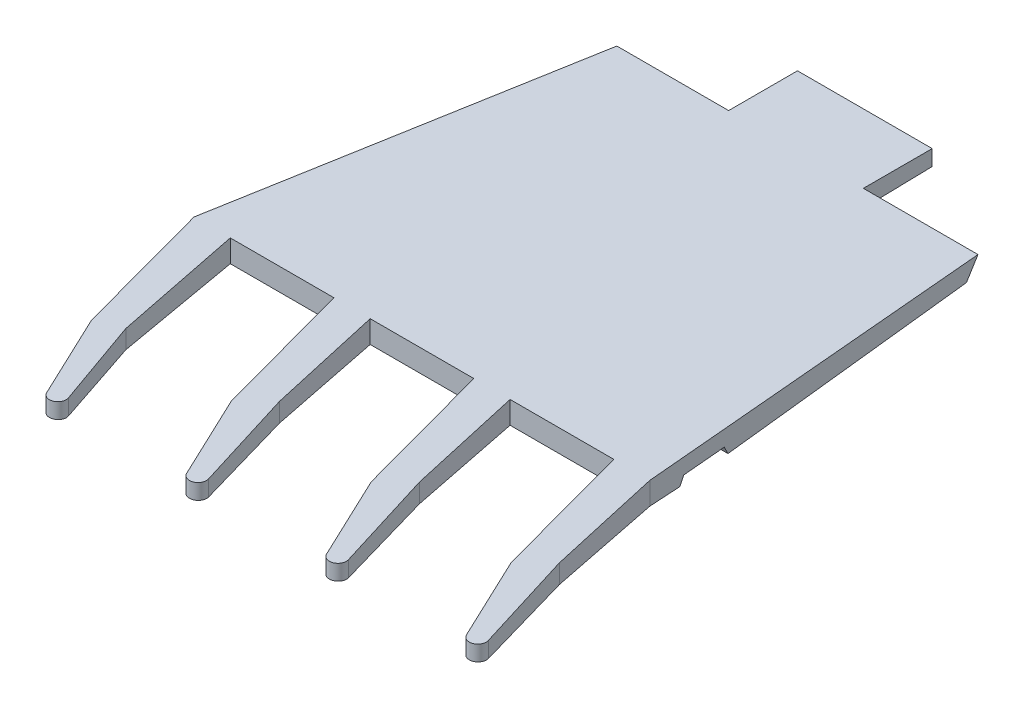
from build123d import *

# Parameters (mm, degrees)
BOSS_EXTRUDE1_START = -28
BOSS_EXTRUDE1_DEPTH = 99.579374
SKETCH3_OUTSIDE_W   = 133.993
SKETCH3_OUTSIDE_H   = 162.204
CUT_EXTRUDE1_DEPTH  = 100.62191519
CUT_EXTRUDE2_START  = 5.803625
CUT_EXTRUDE2_DEPTH  = 106.16593176
CUT_EXTRUDE3_START  = 31.803625
CUT_EXTRUDE3_DEPTH  = 68.55868176


with BuildPart() as part:
    # Sketch2 → Boss-Extrude1 (new body)
    with BuildSketch(Plane(origin=(0, 0, 0), x_dir=(0, 0, -1), z_dir=(1, 0, 0)).offset(BOSS_EXTRUDE1_START)):
        Polygon((2.933887978, -4.509005443), (69.141796865, -3.002833844), (69.107645371, 0), (-58.647538152, 0), (-58.647538152, -2.95683283), (-7.216010497, -4.507485825), (-6.427384886, -3.00760388), (2.14571152, -3.008887422), align=None)
    extrude(amount=BOSS_EXTRUDE1_DEPTH)

    # Sketch3 outside → Cut-Extrude1 (cut, through all)
    with BuildSketch(Plane(origin=(0, 0, 0), x_dir=(1, 0, 0), z_dir=(0, 1, 0))):
        with Locations((21.7895, 5.247)):
            Rectangle(SKETCH3_OUTSIDE_W, SKETCH3_OUTSIDE_H)
        with BuildLine():
            Line((-28, -13.55551403), (-20.63757447, -40.708643472))
            Line((-20.63757447, -40.708643472), (-12.858995884, -57.128824119))
            ThreePointArc((-12.858995884, -57.128824119), (-10.789353945, -57.92833017), (-9.884782678, -55.902403591))
            Line((-9.884782678, -55.902403591), (-15.939111366, -38.776868951))
            Line((-15.939111366, -38.776868951), (-21, -13.55551403))
            Line((-21, -13.55551403), (-1, -13.55551403))
            Line((-1, -13.55551403), (6.36242553, -40.708643472))
            Line((6.36242553, -40.708643472), (14.127689055, -57.10071671))
            ThreePointArc((14.127689055, -57.10071671), (16.204899684, -57.927331709), (17.177753002, -55.914459936))
            Line((17.177753002, -55.914459936), (11.060888634, -36.101526091))
            Line((11.060888634, -36.101526091), (6, -13.55551403))
            Line((6, -13.55551403), (26, -13.55551403))
            Line((26, -13.55551403), (33.36242553, -40.708643472))
            Line((33.36242553, -40.708643472), (41.127689055, -57.10071671))
            ThreePointArc((41.127689055, -57.10071671), (43.204899684, -57.927331709), (44.177753002, -55.914459936))
            Line((44.177753002, -55.914459936), (38.060888634, -36.101526091))
            Line((38.060888634, -36.101526091), (33, -13.55551403))
            Line((33, -13.55551403), (53, -13.55551403))
            Line((53, -13.55551403), (60.36242553, -40.708643472))
            Line((60.36242553, -40.708643472), (68.127689055, -57.10071671))
            ThreePointArc((68.127689055, -57.10071671), (70.204899684, -57.927331709), (71.177753002, -55.914459936))
            Line((71.177753002, -55.914459936), (65.060888634, -36.101526091))
            Line((65.060888634, -36.101526091), (60, -13.55551403))
            Line((60, -13.55551403), (52.767910661, 69.107645371))
            Line((52.767910661, 69.107645371), (-13.424254687, 69.107645371))
            Line((-13.424254687, 69.107645371), (-28, -13.55551403))
        make_face(mode=Mode.SUBTRACT)
    extrude(amount=-CUT_EXTRUDE1_DEPTH, mode=Mode.SUBTRACT)

    # Sketch4 → Cut-Extrude2 (cut, through all)
    with BuildSketch(Plane(origin=(0, 0, 0), x_dir=(0, 0, -1), z_dir=(1, 0, 0)).offset(CUT_EXTRUDE2_START)):
        Polygon((53.376332261, -3.361484275), (55.817093933, 0), (69.107645371, 0), (69.141796865, -3.002833844), align=None)
    extrude(amount=-CUT_EXTRUDE2_DEPTH, mode=Mode.SUBTRACT)

    # Sketch4<2> → Cut-Extrude3 (cut, through all)
    with BuildSketch(Plane(origin=(0, 0, 0), x_dir=(0, 0, -1), z_dir=(1, 0, 0)).offset(CUT_EXTRUDE3_START)):
        Polygon((53.376332261, -3.361484275), (55.817093933, 0), (69.107645371, 0), (69.141796865, -3.002833844), align=None)
    extrude(amount=CUT_EXTRUDE3_DEPTH, mode=Mode.SUBTRACT)


solid = part.part
